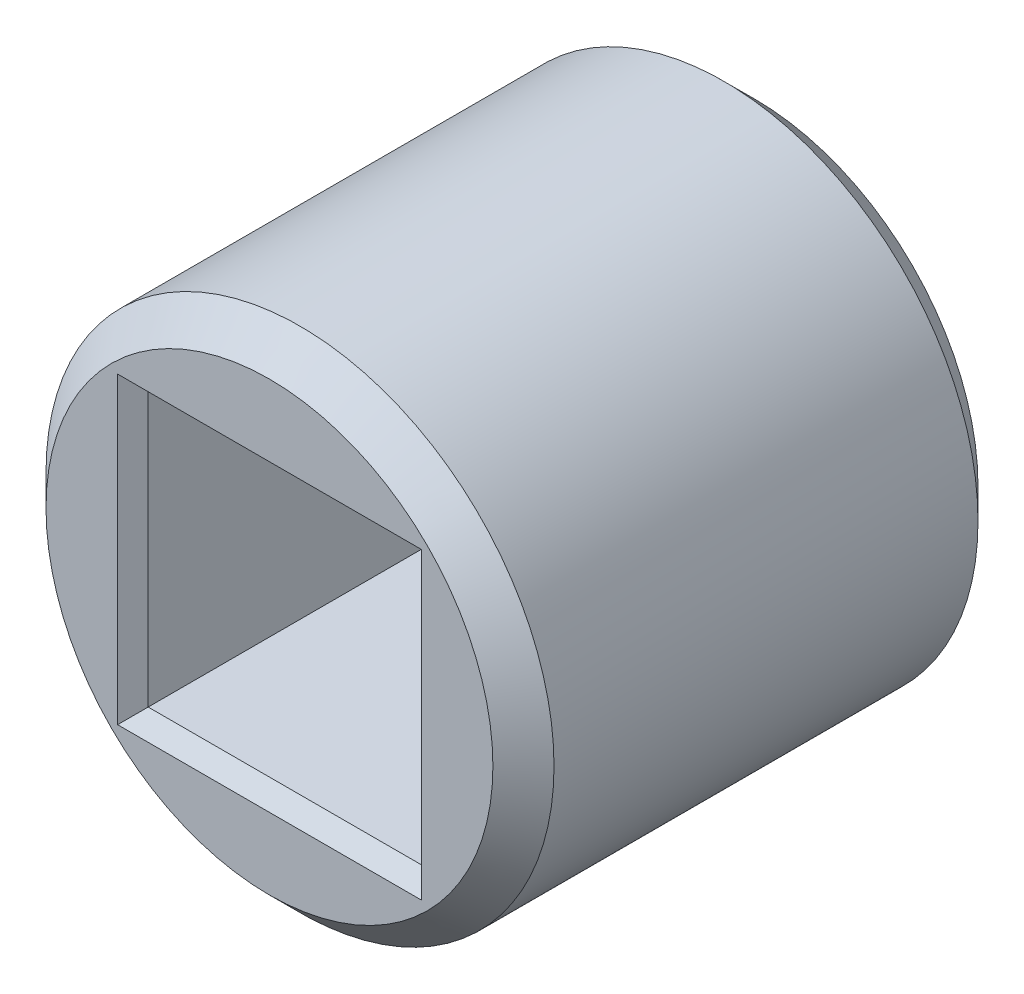
from build123d import *

# Parameters (mm, degrees)
SKETCH1_R           = 3.325
SKETCH1_W           = 3.575
SKETCH1_H           = 3.575
BOSS_EXTRUDE1_DEPTH = 6.35
CHAMFER1_SIZE       = 0.4
CHAMFER2_SIZE       = 0.2


with BuildPart() as part:
    # Sketch1 → Boss-Extrude1 (new body)
    with BuildSketch(Plane.XY):
        Circle(SKETCH1_R)
        Rectangle(SKETCH1_W, SKETCH1_H, mode=Mode.SUBTRACT)
    extrude(amount=BOSS_EXTRUDE1_DEPTH)

    # Chamfer1
    chamfer1_edges = [part.edges().sort_by_distance(p)[0] for p in [
        (-3.325, 0, 0),
        (-3.325, 0, 6.35),
    ]]
    chamfer(chamfer1_edges, length=CHAMFER1_SIZE)

    # Chamfer2
    chamfer2_edges = [part.edges().sort_by_distance(p)[0] for p in [
        (0, -1.7875, 6.35),
        (1.7875, 0, 0),
        (0, 1.7875, 0),
        (-1.7875, 0, 0),
        (0, -1.7875, 0),
        (1.7875, 0, 6.35),
        (0, 1.7875, 6.35),
        (-1.7875, 0, 6.35),
    ]]
    chamfer(chamfer2_edges, length=CHAMFER2_SIZE)


solid = part.part
